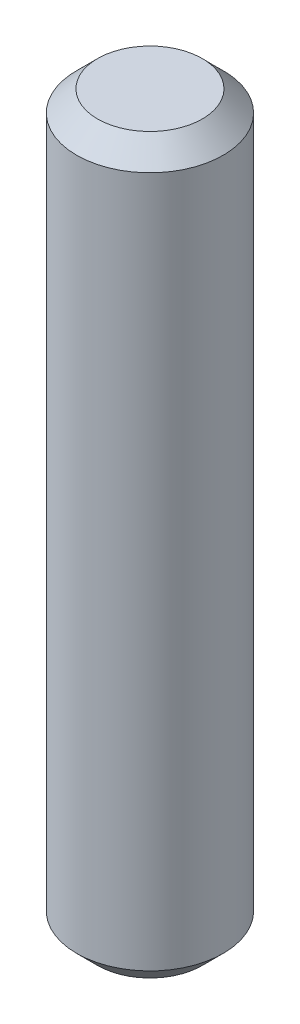
from build123d import *

# Parameters (mm, degrees)
SKETCH2_R           = 7
BOSS_EXTRUDE1_DEPTH = 35
CHAMFER1_SIZE       = 2


with BuildPart() as part:
    # Sketch2 → Boss-Extrude1 (new, symmetric)
    with BuildSketch(Plane(origin=(0, 0, 0), x_dir=(1, 0, 0), z_dir=(0, 1, 0))):
        with Locations(Location((0, 0, 0), (0, 0, 270))):
            Circle(SKETCH2_R)
    extrude(amount=BOSS_EXTRUDE1_DEPTH, both=True)

    # Chamfer1
    chamfer1_edges = [part.edges().sort_by_distance(p)[0] for p in [
        (0, -35, -7),
        (0, 35, -7),
    ]]
    chamfer(chamfer1_edges, length=CHAMFER1_SIZE)


solid = part.part
